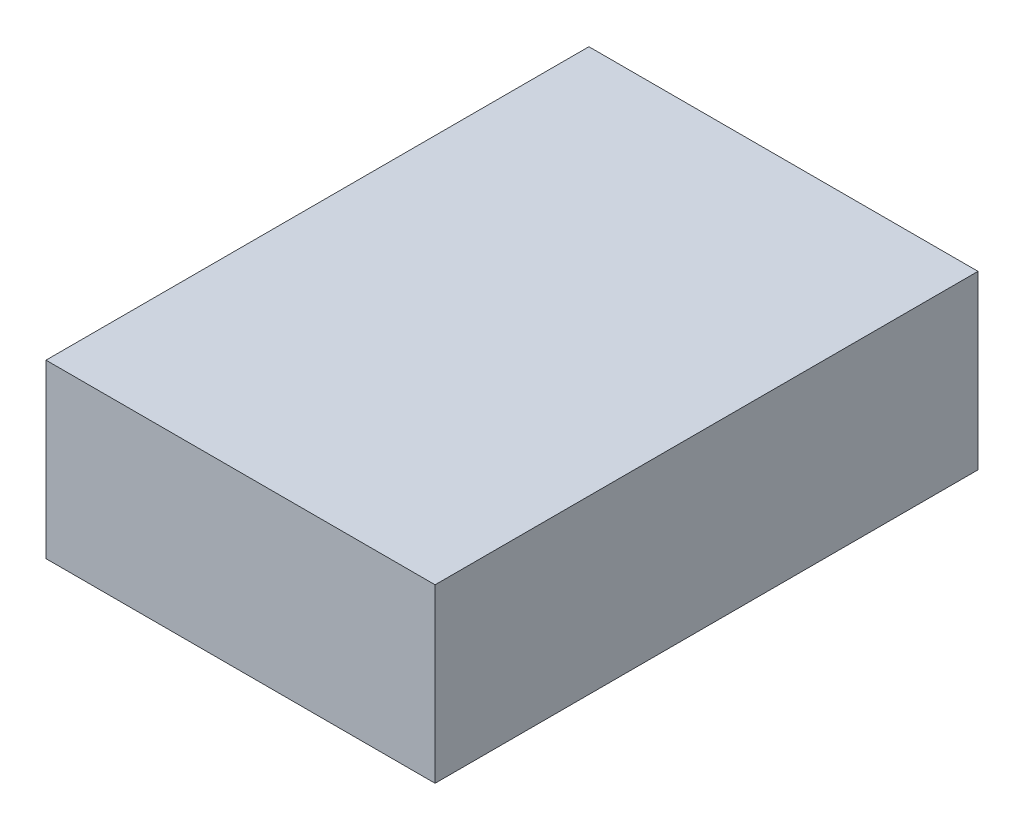
from build123d import *

# Parameters (mm, degrees)
SKETCH1_W           = 54.61
SKETCH1_H           = 76.2
BOSS_EXTRUDE1_DEPTH = 12.065


with BuildPart() as part:
    # Sketch1 → Boss-Extrude1 (new, symmetric)
    with BuildSketch(Plane(origin=(0, 0, 0), x_dir=(1, 0, 0), z_dir=(0, 1, 0))):
        Rectangle(SKETCH1_W, SKETCH1_H)
    extrude(amount=BOSS_EXTRUDE1_DEPTH, both=True)


solid = part.part
